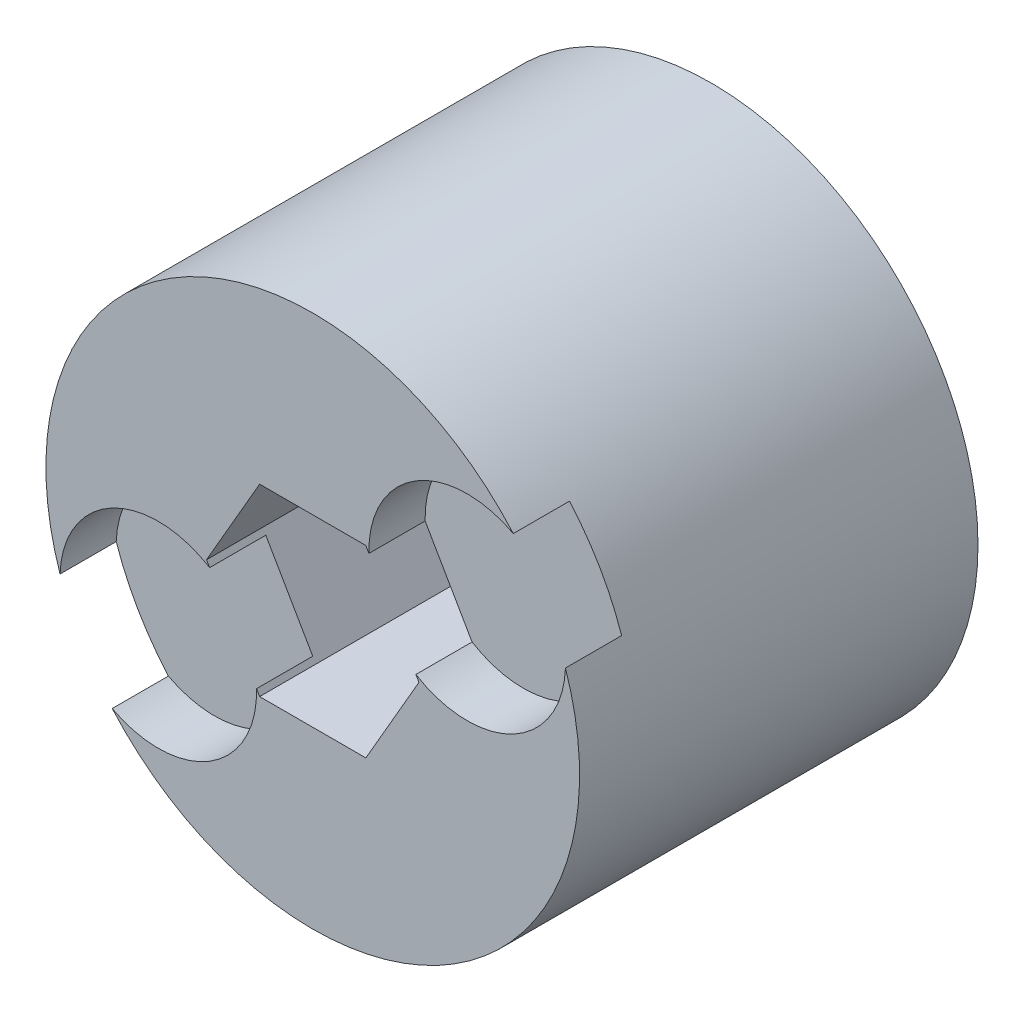
from build123d import *

# Parameters (mm, degrees)
SKETCH1_R           = 9.5
BOSS_EXTRUDE1_DEPTH = 14.185
SKETCH2_R           = 3.5
CUT_EXTRUDE1_DEPTH  = 2


with BuildPart() as part:
    # Sketch1 → Boss-Extrude1 (new body)
    with BuildSketch(Plane.XY):
        with Locations(Location((0, 0, 0), (0, 0, 180))):
            Circle(SKETCH1_R)
        Polygon((1.890822132, -3.275), (-1.890822132, -3.275), (-3.781644263, 0), (-1.890822132, 3.275), (1.890822132, 3.275), (3.781644263, 0), align=None, mode=Mode.SUBTRACT)
    extrude(amount=BOSS_EXTRUDE1_DEPTH)

    # Sketch2 → Cut-Extrude1 (cut)
    with BuildSketch(Plane.XY.offset(14.185)):
        with Locations((5.499261314, 3.175)):
            Circle(SKETCH2_R)
        with Locations((-5.499261314, -3.175)):
            Circle(SKETCH2_R)
    extrude(amount=-CUT_EXTRUDE1_DEPTH, mode=Mode.SUBTRACT)


solid = part.part
